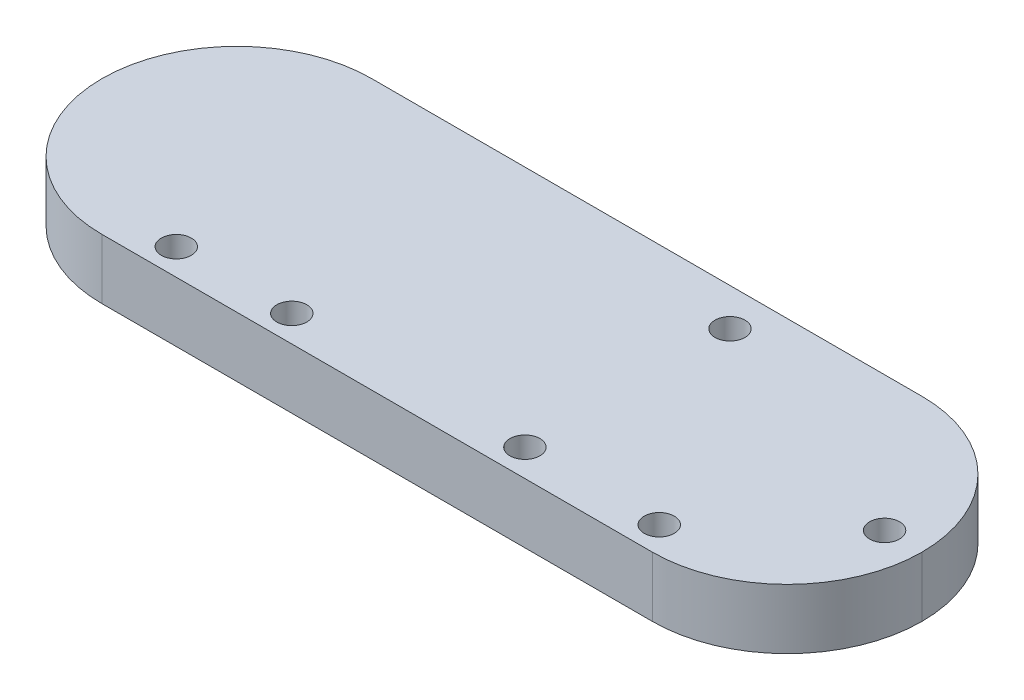
from build123d import *

# Parameters (mm, degrees)
EXTRUDE_1_DEPTH     = 4
SKETCH_2_R          = 1
CUT_EXTRUDE_1_DEPTH = 4


with BuildPart() as part:
    # Эскиз1 → Бобышка-Вытянуть1 (new body)
    with BuildSketch(Plane(origin=(0, 0, 0), x_dir=(1, 0, 0), z_dir=(0, 1, 0))):
        with BuildLine():
            Line((-18.35, -8.99), (18.35, -8.99))
            ThreePointArc((18.35, -8.99), (24.699818895, -6.359818895), (27.33, -0.01))
            Line((27.33, -0.01), (27.33, 0.01))
            ThreePointArc((27.33, 0.01), (24.699818895, 6.359818895), (18.35, 8.99))
            Line((18.35, 8.99), (-18.35, 8.99))
            ThreePointArc((-18.35, 8.99), (-24.699818895, 6.359818895), (-27.33, 0.01))
            Line((-27.33, 0.01), (-27.33, -0.01))
            ThreePointArc((-27.33, -0.01), (-24.699818895, -6.359818895), (-18.35, -8.99))
        make_face()
    extrude(amount=EXTRUDE_1_DEPTH)

    # Эскиз2 → Вырез-Вытянуть1 (cut)
    with BuildSketch(Plane(origin=(0, 4, 0), x_dir=(1, 0, 0), z_dir=(0, 1, 0))):
        with Locations(Location((24.830031036, 0.002457034, 0), (0, 0, 270))):
            Circle(SKETCH_2_R)
        with Locations(Location((8.040031036, 6.49, 0), (0, 0, 270))):
            Circle(SKETCH_2_R)
        with Locations(Location((16.993150744, -7.17903397, 0), (0, 0, 270))):
            Circle(SKETCH_2_R)
        with Locations(Location((8.040031036, -7.17903397, 0), (0, 0, 270))):
            Circle(SKETCH_2_R)
        with Locations(Location((-15.151115416, -7.225126503, 0), (0, 0, 270))):
            Circle(SKETCH_2_R)
        with Locations(Location((-7.452088862, -7.225126503, 0), (0, 0, 270))):
            Circle(SKETCH_2_R)
    extrude(amount=-CUT_EXTRUDE_1_DEPTH, mode=Mode.SUBTRACT)


solid = part.part
